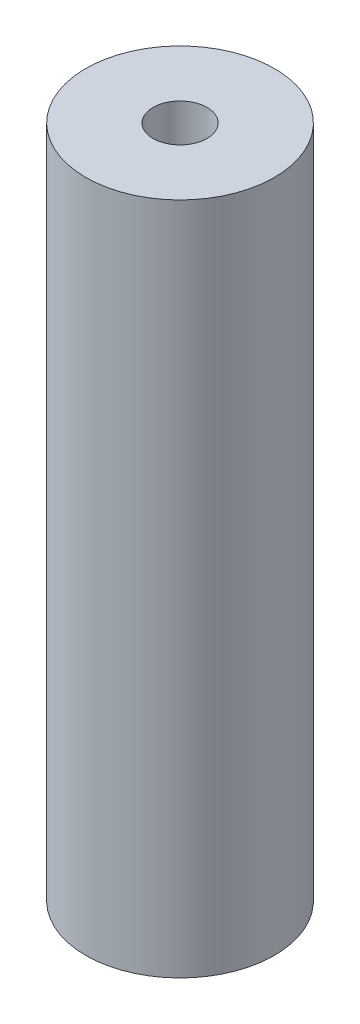
from build123d import *

# Parameters (mm, degrees)
SKETCH1_R           = 7
SKETCH1_R_2         = 2
BOSS_EXTRUDE1_DEPTH = 50


with BuildPart() as part:
    # Sketch1 → Boss-Extrude1 (new body)
    with BuildSketch(Plane(origin=(0, 0, 0), x_dir=(1, 0, 0), z_dir=(0, 1, 0))):
        with Locations(Location((0, 0, 0), (0, 0, 270))):
            Circle(SKETCH1_R)
        with Locations(Location((0, 0, 0), (0, 0, 270))):
            Circle(SKETCH1_R_2, mode=Mode.SUBTRACT)
    extrude(amount=BOSS_EXTRUDE1_DEPTH)


solid = part.part
